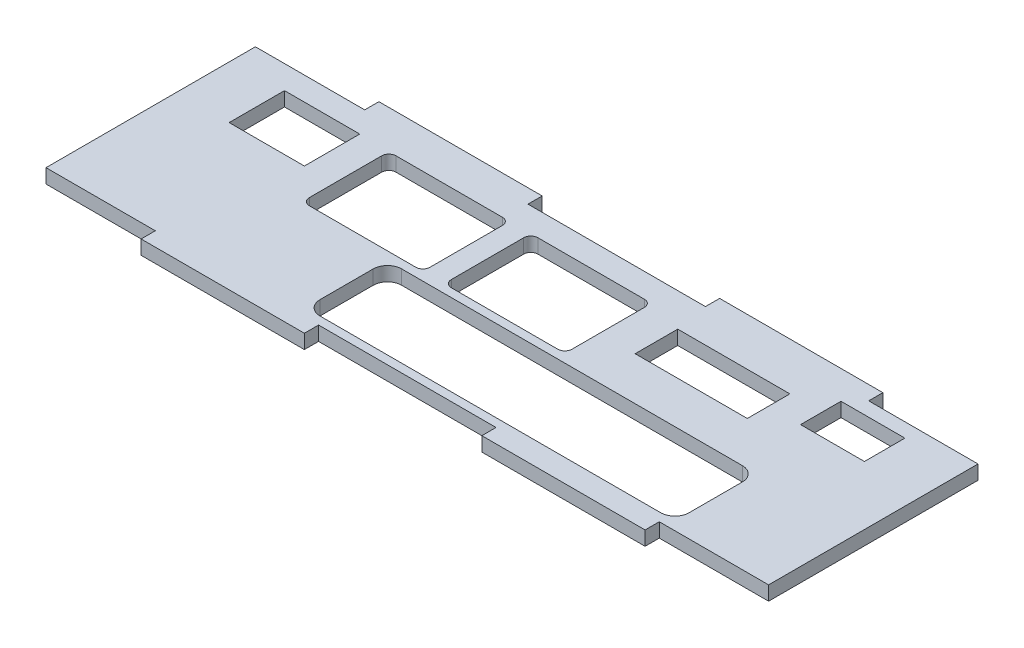
from build123d import *

# Parameters (mm, degrees)
SKETCH_1_W                     = 101.8
SKETCH_1_H                     = 29.5
EXTRUDE_1_DEPTH                = 2
SKETCH_2_W                     = 23
SKETCH_2_H                     = 2
EXTRUDE_2_DEPTH                = 2
SKETCH_3_W                     = 9
SKETCH_3_H                     = 5.7
CUT_EXTRUDE_1_DEPTH            = 54.622499942
SKETCH_4_W                     = 10.6
SKETCH_4_H                     = 7.8
CUT_EXTRUDE_2_DEPTH            = 54.622499942
SKETCH_6_W                     = 17
SKETCH_6_H                     = 12.2
CUT_EXTRUDE_4_DEPTH            = 54.622499942
FILLET_1_R                     = 1
PATTERN_LINEAR_1_COUNT         = 2
PATTERN_LINEAR_1_PITCH         = 20
FILLET_1_OF_PATTERN_LINEAR_1_R = 1
SKETCH_7_W                     = 15.8
SKETCH_7_H                     = 6
CUT_EXTRUDE_5_DEPTH            = 54.622499942
CUT_EXTRUDE_6_DEPTH            = 54.622499942


with BuildPart() as part:
    # 草图1 → 凸台-拉伸1 (new body)
    with BuildSketch(Plane(origin=(0, 0, 0), x_dir=(1, 0, 0), z_dir=(0, 1, 0))):
        Rectangle(SKETCH_1_W, SKETCH_1_H)
    extrude(amount=EXTRUDE_1_DEPTH)

    # 草图2 → 凸台-拉伸2 (add)
    with BuildSketch(Plane(origin=(0, 2, 0), x_dir=(1, 0, 0), z_dir=(0, 1, 0))):
        with Locations((-24, 15.75)):
            Rectangle(SKETCH_2_W, SKETCH_2_H)
        with Locations((24, 15.75)):
            Rectangle(SKETCH_2_W, SKETCH_2_H)
        with Locations((24, -15.75)):
            Rectangle(SKETCH_2_W, SKETCH_2_H)
        with Locations((-24, -15.75)):
            Rectangle(SKETCH_2_W, SKETCH_2_H)
    extrude(amount=-EXTRUDE_2_DEPTH)

    # 草图3 → 切除-拉伸1 (cut, through all)
    with BuildSketch(Plane(origin=(0, 2, 0), x_dir=(1, 0, 0), z_dir=(0, 1, 0))):
        with Locations((38.1, 9.9)):
            Rectangle(SKETCH_3_W, SKETCH_3_H)
    extrude(amount=-CUT_EXTRUDE_1_DEPTH, mode=Mode.SUBTRACT)

    # 草图4 → 切除-拉伸2 (cut, through all)
    with BuildSketch(Plane(origin=(0, 2, 0), x_dir=(1, 0, 0), z_dir=(0, 1, 0))):
        with Locations((-38.2, 7.55)):
            Rectangle(SKETCH_4_W, SKETCH_4_H)
    extrude(amount=-CUT_EXTRUDE_2_DEPTH, mode=Mode.SUBTRACT)

    # 草图6 → 切除-拉伸4 (cut, through all)
    with BuildSketch(Plane(origin=(0, 2, 0), x_dir=(1, 0, 0), z_dir=(0, 1, 0))):
        with Locations((-20.2, 5.25)):
            Rectangle(SKETCH_6_W, SKETCH_6_H)
    cut_extrude_4 = extrude(amount=-CUT_EXTRUDE_4_DEPTH, mode=Mode.SUBTRACT)

    # 圆角1
    fillet_1_edges = [part.edges().sort_by_distance(p)[0] for p in [
        (-28.7, 1, 0.85),
        (-28.7, 1, -11.35),
        (-11.7, 1, -11.35),
        (-11.7, 1, 0.85),
    ]]
    fillet(fillet_1_edges, radius=FILLET_1_R)

    # 阵列(线性)1: 切除-拉伸4 ×2
    with Locations(*[(i * PATTERN_LINEAR_1_PITCH, 0, 0) for i in range(1, PATTERN_LINEAR_1_COUNT)]):
        add(cut_extrude_4, mode=Mode.SUBTRACT)

    # 圆角1 of 阵列(线性)1
    fillet_1_of_pattern_linear_1_edges = [part.edges().sort_by_distance(p)[0] for p in [
        (-8.7, 1, 0.85),
        (-8.7, 1, -11.35),
        (8.3, 1, -11.35),
        (8.3, 1, 0.85),
    ]]
    fillet(fillet_1_of_pattern_linear_1_edges, radius=FILLET_1_OF_PATTERN_LINEAR_1_R)

    # 草图7 → 切除-拉伸5 (cut, through all)
    with BuildSketch(Plane(origin=(0, 2, 0), x_dir=(1, 0, 0), z_dir=(0, 1, 0))):
        with Locations((21.2, 7.05)):
            Rectangle(SKETCH_7_W, SKETCH_7_H)
    extrude(amount=-CUT_EXTRUDE_5_DEPTH, mode=Mode.SUBTRACT)

    # 草图8 → 切除-拉伸6 (cut, through all)
    with BuildSketch(Plane(origin=(0, 2, 0), x_dir=(1, 0, 0), z_dir=(0, 1, 0))):
        with BuildLine():
            Line((-13.5, -2.05), (34.5, -2.05))
            ThreePointArc((34.5, -2.05), (35.914213562, -2.635786438), (36.5, -4.05))
            Line((36.5, -4.05), (36.5, -11.55))
            ThreePointArc((36.5, -11.55), (35.914213562, -12.964213562), (34.5, -13.55))
            Line((34.5, -13.55), (-13.5, -13.55))
            ThreePointArc((-13.5, -13.55), (-14.914213562, -12.964213562), (-15.5, -11.55))
            Line((-15.5, -11.55), (-15.5, -4.05))
            ThreePointArc((-15.5, -4.05), (-14.914213562, -2.635786438), (-13.5, -2.05))
        make_face()
    extrude(amount=-CUT_EXTRUDE_6_DEPTH, mode=Mode.SUBTRACT)


solid = part.part
